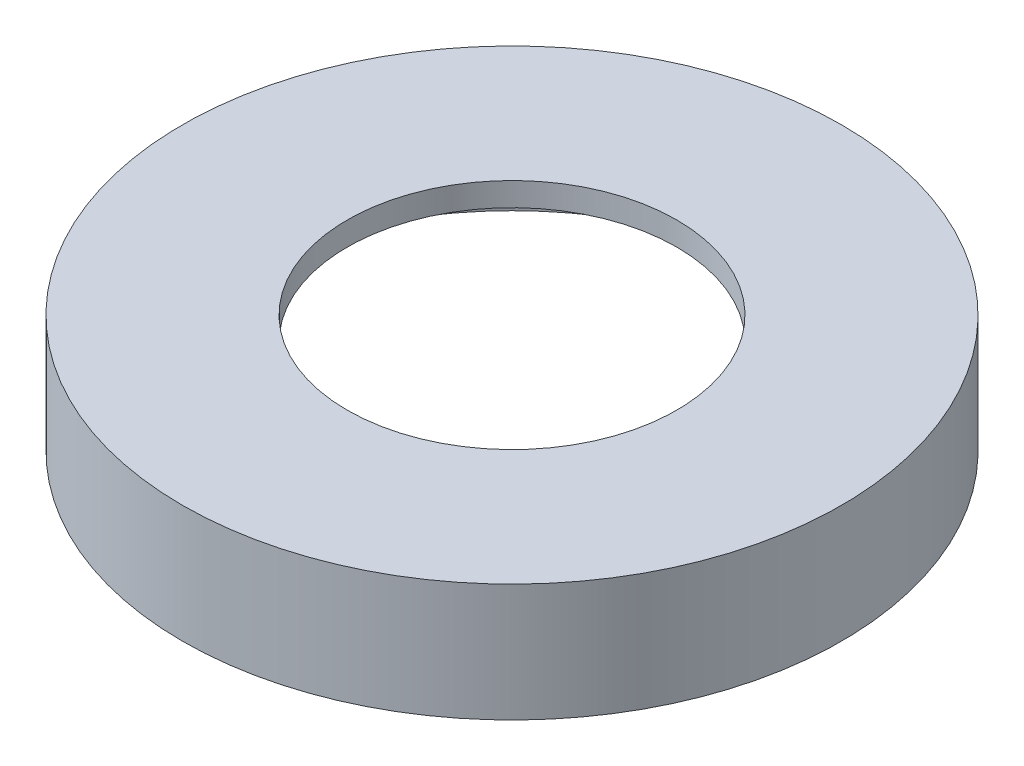
from build123d import *

# Parameters (mm, degrees)
SKETCH_3_R          = 7
CUT_EXTRUDE_1_DEPTH = 10


with BuildPart() as part:
    # 草图2 → 旋转1 (revolve)
    with BuildSketch(Plane.XY, mode=Mode.PRIVATE) as revolve_1_sk:
        Polygon((0, 5), (14, 5), (14, 0), (12.5, 0), (12.5, 4), (0, 4), align=None)
    revolve(revolve_1_sk.sketch.rotate(Axis((0, 0, 0), (0, 1, 0)), 90), axis=Axis((0, 0, 0), (0, 1, 0)))

    # 草图3 → 切除-拉伸1 (cut)
    with BuildSketch(Plane.XZ.offset(-4)):
        with Locations(Location((0, 0, 0), (0, 0, 270))):
            Circle(SKETCH_3_R)
    extrude(amount=-CUT_EXTRUDE_1_DEPTH, mode=Mode.SUBTRACT)


solid = part.part
